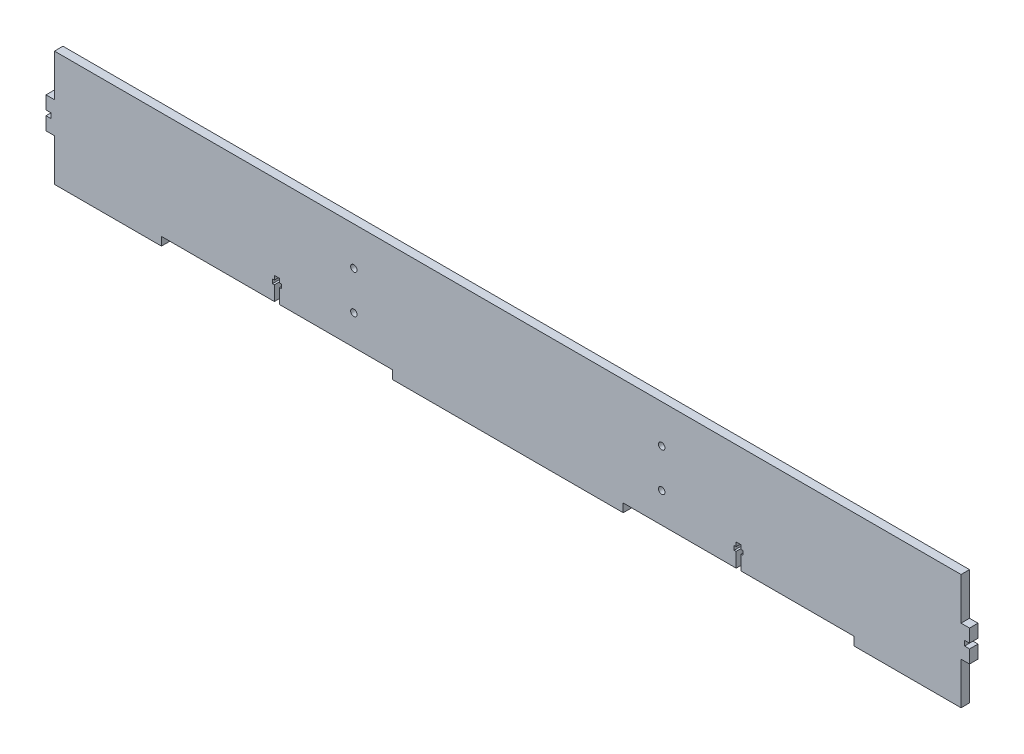
from build123d import *

# Parameters (mm, degrees)
BOSS_EXTRUDE1_DEPTH = 5.5
SKETCH2_R           = 2.1
CUT_EXTRUDE1_DEPTH  = 907.379197687


with BuildPart() as part:
    # Sketch1 → Boss-Extrude1 (new body)
    with BuildSketch(Plane.XY):
        Polygon((308.5, 78), (308.5, 50.625), (303, 50.625), (303, 42.125), (306.25, 42.125), (306.25, 40.5), (306.25, 38.875), (303, 38.875), (303, 30.375), (308.5, 30.375), (308.5, 3), (378, 3), (378, 8.5), (451.375, 8.5), (451.375, 17.95), (450.125, 17.95), (450.125, 20.6), (451.375, 20.6), (451.375, 23.25), (454.625, 23.25), (454.625, 20.6), (455.875, 20.6), (455.875, 17.95), (454.625, 17.95), (454.625, 8.5), (528, 8.5), (528, 3), (678, 3), (678, 8.5), (751.375, 8.5), (751.375, 17.95), (750.125, 17.95), (750.125, 20.6), (751.375, 20.6), (751.375, 23.25), (754.625, 23.25), (754.625, 20.6), (755.875, 20.6), (755.875, 17.95), (754.625, 17.95), (754.625, 8.5), (828, 8.5), (828, 3), (897.5, 3), (897.5, 30.375), (903, 30.375), (903, 38.875), (899.75, 38.875), (899.75, 40.5), (899.75, 42.125), (903, 42.125), (903, 50.625), (897.5, 50.625), (897.5, 78), align=None)
    extrude(amount=BOSS_EXTRUDE1_DEPTH)

    # Sketch2 → Cut-Extrude1 (cut, through all)
    with BuildSketch(Plane.XY.offset(5.5)):
        with Locations((503, 53)):
            Circle(SKETCH2_R)
        with Locations((503, 28)):
            Circle(SKETCH2_R)
        with Locations((703, 28)):
            Circle(SKETCH2_R)
        with Locations((703, 53)):
            Circle(SKETCH2_R)
    extrude(amount=-CUT_EXTRUDE1_DEPTH, mode=Mode.SUBTRACT)


solid = part.part
